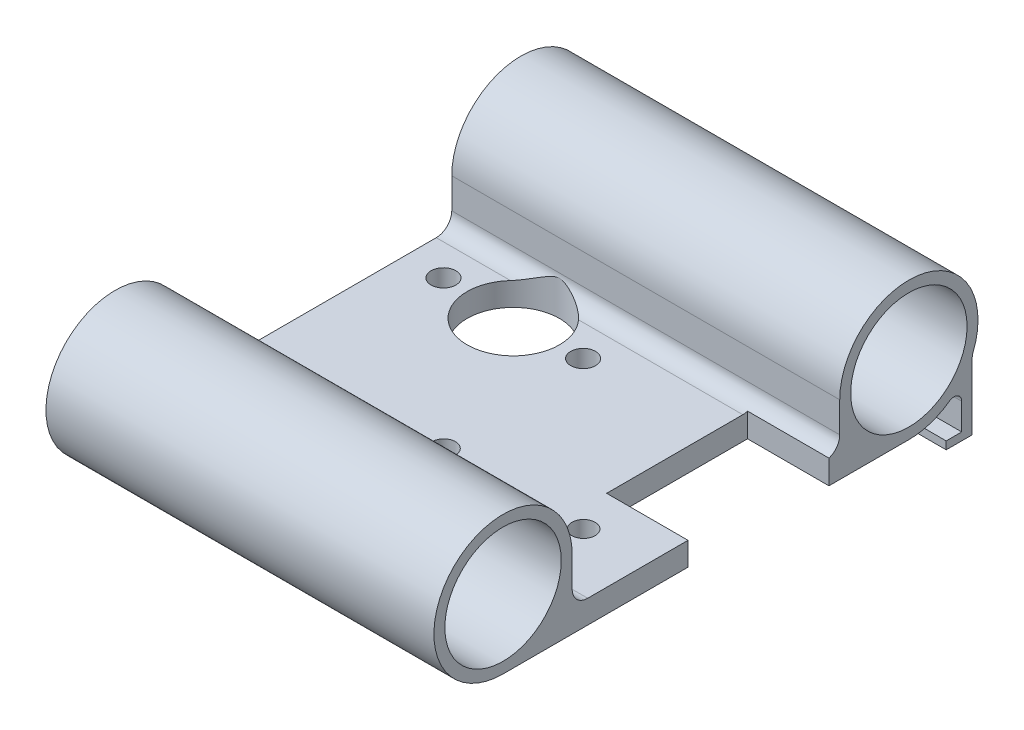
from build123d import *

# Parameters (mm, degrees)
EXTRUDE_1_DEPTH      = 25
EXTRUDE_1_DEPTH_BACK = 25
SKETCH_1_R           = 7.5
SKETCH_2_R           = 1.6
SKETCH_2_R_2         = 5.95
SKETCH_2_W           = 10.49
SKETCH_2_H           = 18.16
EXTRUDE_2_DEPTH      = 25
SKETCH_3_R           = 2.05
EXTRUDE_3_DEPTH      = 25
SKETCH_4_R           = 1.5
EXTRUDE_4_DEPTH      = 10


with BuildPart() as part:
    # Эскиз1 → Выдавливание1 (new, two sides: drawn at the far end of the back side and taken through both)
    with BuildSketch(Plane.YZ.offset(-EXTRUDE_1_DEPTH_BACK)):
        with BuildLine():
            Line((-8.91, -52.3), (-8.91, 0))
            ThreePointArc((-8.91, 0), (6.30032142, 6.30032142), (0, -8.91))
            Line((0, -8.91), (-3.91, -8.91))
            ThreePointArc((-3.91, -8.91), (-5.324213562, -9.495786438), (-5.91, -10.91))
            Line((-5.91, -10.91), (-5.91, -41.39))
            ThreePointArc((-5.91, -41.39), (-5.324213562, -42.804213562), (-3.91, -43.39))
            Line((-3.91, -43.39), (0, -43.39))
            ThreePointArc((0, -43.39), (8.753455219, -53.962865516), (-3.2672994, -60.589321723))
            ThreePointArc((-3.2672994, -60.589321723), (-3.627441686, -60.48513912), (-4.000699939, -60.45))
            Line((-4.000699939, -60.45), (-12.45, -60.45))
            Line((-12.45, -60.45), (-12.45, -57.11))
            Line((-12.45, -57.11), (-11.45, -57.11))
            Line((-11.45, -57.11), (-11.45, -59.11))
            Line((-11.45, -59.11), (-8.028200296, -59.11))
            ThreePointArc((-8.028200296, -59.11), (-7.137617204, -58.564820575), (-7.218089268, -57.523723512))
            ThreePointArc((-7.218089268, -57.523723512), (-8.476475546, -55.045443919), (-8.91, -52.3))
        make_face()
        with Locations(Location((0, 0, 0), (0, 0, 270))):
            Circle(SKETCH_1_R, mode=Mode.SUBTRACT)
        with Locations(Location((0, -52.3, 0), (0, 0, 270))):
            Circle(SKETCH_1_R, mode=Mode.SUBTRACT)
    extrude(amount=EXTRUDE_1_DEPTH + EXTRUDE_1_DEPTH_BACK)

    # Эскиз2 → Выдавливание2 (cut, symmetric)
    with BuildSketch(Plane(origin=(-25, -5.91, -8.91), x_dir=(1, 0, 0), z_dir=(0, 1, 0))):
        with Locations(Location((4.95, 28.46, 0), (0, 0, 90))):
            Circle(SKETCH_2_R)
        with Locations(Location((22.95, 28.46, 0), (0, 0, 90))):
            Circle(SKETCH_2_R)
        with Locations(Location((13.95, 28.46, 0), (0, 0, 137.496887959))):
            Circle(SKETCH_2_R_2)
        with Locations((44.755, 24.01)):
            Rectangle(SKETCH_2_W, SKETCH_2_H)
    extrude(amount=EXTRUDE_2_DEPTH, both=True, mode=Mode.SUBTRACT)

    # Эскиз3 → Выдавливание3 (cut, symmetric)
    with BuildSketch(Plane(origin=(0, -5.91, 0), x_dir=(-1, 0, 0), z_dir=(0, 1, 0))):
        with Locations(Location((10.95, -11.14, 0), (0, 0, 6.441870255))):
            Circle(SKETCH_3_R)
        with Locations(Location((-12.55, -11.14, 0), (0, 0, 6.441870255))):
            Circle(SKETCH_3_R)
    extrude(amount=EXTRUDE_3_DEPTH, both=True, mode=Mode.SUBTRACT)

    # Эскиз4 → Выдавливание4 (cut)
    with BuildSketch(Plane(origin=(0, -5.91, 0), x_dir=(-1, 0, 0), z_dir=(0, 1, 0))):
        with Locations(Location((-17, -18.37, 0), (0, 0, 90))):
            Circle(SKETCH_4_R)
        with Locations(Location((1, -18.37, 0), (0, 0, 90))):
            Circle(SKETCH_4_R)
    extrude(amount=-EXTRUDE_4_DEPTH, mode=Mode.SUBTRACT)


solid = part.part
